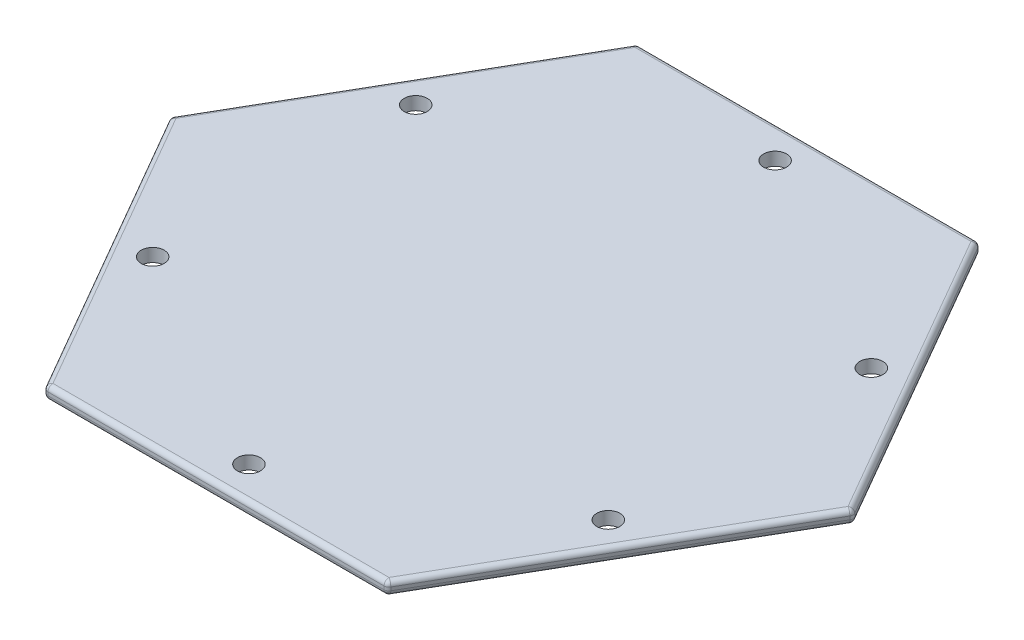
from build123d import *

# Parameters (mm, degrees)
BOSS_EXTRUDE1_DEPTH     = 2
FILLET3_R               = 0.75
CUT_EXTRUDE2_DEPTH      = 69.680097177
CUT_EXTRUDE2_DEPTH_BACK = 35
SKETCH3_R               = 1.75


with BuildPart() as part:
    # Sketch2 → Boss-Extrude1 (new body)
    with BuildSketch(Plane(origin=(0, 0, 0), x_dir=(1, 0, 0), z_dir=(0, 1, 0))):
        Polygon((51.961524227, 0), (25.980762114, 45), (-25.980762114, 45), (-51.961524227, 0), (-25.980762114, -45), (25.980762114, -45), align=None)
    extrude(amount=BOSS_EXTRUDE1_DEPTH)

    # Fillet3
    fillet3_edges = [part.edges().sort_by_distance(p)[0] for p in [
        (25.980762114, 1, 45),
        (51.961524227, 1, 0),
        (25.980762114, 1, -45),
        (-25.980762114, 1, 45),
        (-25.980762114, 1, -45),
        (-51.961524227, 1, 0),
        (38.97114317, 0, -22.5),
        (0, 0, -45),
        (-38.97114317, 0, -22.5),
        (-38.97114317, 0, 22.5),
        (0, 0, 45),
        (38.97114317, 0, 22.5),
        (0, 2, 45),
        (-38.97114317, 2, 22.5),
        (-38.97114317, 2, -22.5),
        (0, 2, -45),
        (38.97114317, 2, -22.5),
        (38.97114317, 2, 22.5),
    ]]
    fillet(fillet3_edges, radius=FILLET3_R)

    # Sketch3 → Cut-Extrude2 (cut, two sides: drawn at the far end of the back side and taken through both)
    with BuildSketch(Plane(origin=(0, 0, 0), x_dir=(1, 0, 0), z_dir=(0, 1, 0)).offset(-CUT_EXTRUDE2_DEPTH_BACK)):
        with Locations((0, 40)):
            Circle(SKETCH3_R)
        with Locations((34.641016151, 20)):
            Circle(SKETCH3_R)
        with Locations((34.641016151, -20)):
            Circle(SKETCH3_R)
        with Locations((0, -40)):
            Circle(SKETCH3_R)
        with Locations((-34.641016151, -20)):
            Circle(SKETCH3_R)
        with Locations((-34.641016151, 20)):
            Circle(SKETCH3_R)
    extrude(amount=CUT_EXTRUDE2_DEPTH + CUT_EXTRUDE2_DEPTH_BACK, mode=Mode.SUBTRACT)


solid = part.part
